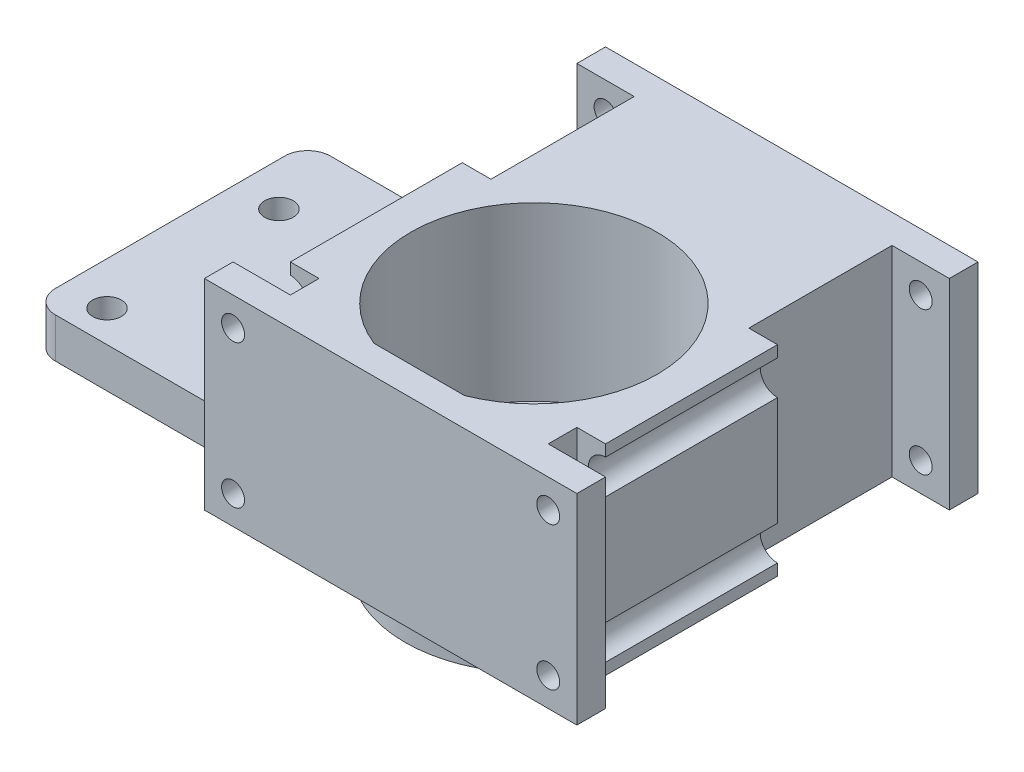
from build123d import *

# Parameters (mm, degrees)
SKETCH_1_W          = 45
SKETCH_1_H          = 70
SKETCH_1_R          = 21.5
EXTRUDE_1_DEPTH     = 35
SKETCH_2_R          = 21.5
EXTRUDE_2_DEPTH     = 5
SKETCH_3_R          = 2
SKETCH_3_R_2        = 13
CUT_EXTRUDE_1_DEPTH = 10
SKETCH_5_W          = 10
SKETCH_5_H          = 35
EXTRUDE_3_DEPTH     = 5
SKETCH_6_R          = 2
CUT_EXTRUDE_2_DEPTH = 5
EXTRUDE_START       = 5
SKETCH_8_R          = 22.5
SKETCH_8_R_2        = 13
SKETCH_8_R_3        = 2
EXTRUDE_5_DEPTH     = 5
SKETCH_9_R          = 4
CUT_EXTRUDE_3_DEPTH = 5
EXTRUDE_6_DEPTH     = 7
SKETCH_11_W         = 25
SKETCH_11_H         = 15
EXTRUDE_7_DEPTH     = 7
FILLET_1_R          = 4
SKETCH_12_R         = 2.5
CUT_EXTRUDE_4_DEPTH = 10
SKETCH_13_W         = 5
SKETCH_13_H         = 30
EXTRUDE_8_DEPTH     = 35
SKETCH_14_W         = 65
SKETCH_14_H         = 35
EXTRUDE_9_DEPTH     = 5
CUT_EXTRUDE_START   = -5
SKETCH_16_R         = 2
CUT_EXTRUDE_5_DEPTH = 5
SKETCH_18_R         = 3
CUT_EXTRUDE_6_DEPTH = 31


with BuildPart() as part:
    # 草图1 → 凸台-拉伸1 (new body)
    with BuildSketch(Plane(origin=(0, 0, 0), x_dir=(1, 0, 0), z_dir=(0, 1, 0))):
        Rectangle(SKETCH_1_W, SKETCH_1_H)
        with Locations(Location((0, -10, 0), (0, 0, 270))):
            Circle(SKETCH_1_R, mode=Mode.SUBTRACT)
    extrude(amount=EXTRUDE_1_DEPTH)

    # 草图2 → 凸台-拉伸2 (add)
    with BuildSketch(Plane.XZ):
        with Locations(Location((0, 10, 0), (0, 0, 270))):
            Circle(SKETCH_2_R)
    extrude(amount=-EXTRUDE_2_DEPTH)

    # 草图3 → 切除-拉伸1 (cut)
    with BuildSketch(Plane.XZ):
        with Locations(Location((0, -7.5, 0), (0, 0, 270))):
            Circle(SKETCH_3_R)
        with Locations(Location((-17.5, 10, 0), (0, 0, 270))):
            Circle(SKETCH_3_R)
        with Locations(Location((0, 27.5, 0), (0, 0, 270))):
            Circle(SKETCH_3_R)
        with Locations(Location((17.5, 10, 0), (0, 0, 270))):
            Circle(SKETCH_3_R)
        with Locations(Location((0, 10, 0), (0, 0, 270))):
            Circle(SKETCH_3_R_2)
    extrude(amount=-CUT_EXTRUDE_1_DEPTH, mode=Mode.SUBTRACT)

    # 草图5 → 凸台-拉伸3 (add)
    with BuildSketch(Plane(origin=(0, 0, -35), x_dir=(-1, 0, 0), z_dir=(0, 0, -1))):
        with Locations((27.5, 17.5)):
            Rectangle(SKETCH_5_W, SKETCH_5_H)
        with Locations((-27.5, 17.5)):
            Rectangle(SKETCH_5_W, SKETCH_5_H)
    extrude(amount=-EXTRUDE_3_DEPTH)

    # 草图6 → 切除-拉伸2 (cut)
    with BuildSketch(Plane.XY.offset(-30)):
        with Locations((27.5, 30)):
            Circle(SKETCH_6_R)
        with Locations((27.5, 5)):
            Circle(SKETCH_6_R)
        with Locations((-27.5, 30)):
            Circle(SKETCH_6_R)
        with Locations((-27.5, 5)):
            Circle(SKETCH_6_R)
    extrude(amount=-CUT_EXTRUDE_2_DEPTH, mode=Mode.SUBTRACT)

    # 草图8 → 凸台-拉伸5 (add)
    with BuildSketch(Plane.XZ.offset(EXTRUDE_START)):
        with Locations(Location((0, 10, 0), (0, 0, 180))):
            Circle(SKETCH_8_R)
        with Locations(Location((0, 10, 0), (0, 0, 270))):
            Circle(SKETCH_8_R_2, mode=Mode.SUBTRACT)
        with Locations(Location((-17.5, 10, 0), (0, 0, 270))):
            Circle(SKETCH_8_R_3, mode=Mode.SUBTRACT)
        with Locations(Location((0, -7.5, 0), (0, 0, 270))):
            Circle(SKETCH_8_R_3, mode=Mode.SUBTRACT)
        with Locations(Location((17.5, 10, 0), (0, 0, 270))):
            Circle(SKETCH_8_R_3, mode=Mode.SUBTRACT)
        with Locations(Location((0, 27.5, 0), (0, 0, 270))):
            Circle(SKETCH_8_R_3, mode=Mode.SUBTRACT)
    extrude(amount=-EXTRUDE_5_DEPTH)

    # 草图9 → 切除-拉伸3 (cut)
    with BuildSketch(Plane.XZ.offset(5)):
        with Locations(Location((0, 27.5, 0), (0, 0, 270))):
            Circle(SKETCH_9_R)
        with Locations(Location((-17.5, 10, 0), (0, 0, 270))):
            Circle(SKETCH_9_R)
        with Locations(Location((17.5, 10, 0), (0, 0, 270))):
            Circle(SKETCH_9_R)
        with Locations(Location((0, -7.5, 0), (0, 0, 270))):
            Circle(SKETCH_9_R)
    extrude(amount=-CUT_EXTRUDE_3_DEPTH, mode=Mode.SUBTRACT)

    # 草图10 → 凸台-拉伸6 (add)
    with BuildSketch(Plane.XZ.offset(5)):
        with BuildLine():
            Line((-19.899748742, 20.5), (-77, 20.5))
            Line((-77, 20.5), (-77, -12.5))
            Line((-77, -12.5), (0, -12.5))
            ThreePointArc((0, -12.5), (-19.267848868, -1.618950039), (-19.899748742, 20.5))
        make_face()
    extrude(amount=-EXTRUDE_6_DEPTH)

    # 草图11 → 凸台-拉伸7 (add)
    with BuildSketch(Plane.XZ.offset(5)):
        with Locations((-64.5, -20)):
            Rectangle(SKETCH_11_W, SKETCH_11_H)
    extrude(amount=-EXTRUDE_7_DEPTH)

    # 圆角1
    fillet_1_edges = [part.edges().sort_by_distance(p)[0] for p in [
        (-77, -1.5, 20.5),
        (-77, -1.5, -27.5),
        (-52, -1.5, -12.5),
        (-52, -1.5, -27.5),
    ]]
    fillet(fillet_1_edges, radius=FILLET_1_R)

    # 草图12 → 切除-拉伸4 (cut)
    with BuildSketch(Plane.XZ.offset(5)):
        with Locations(Location((-69.5, -15, 0), (0, 0, 270))):
            Circle(SKETCH_12_R)
        with Locations(Location((-69.5, 15, 0), (0, 0, 270))):
            Circle(SKETCH_12_R)
    extrude(amount=-CUT_EXTRUDE_4_DEPTH, mode=Mode.SUBTRACT)

    # 草图13 → 凸台-拉伸8 (add)
    with BuildSketch(Plane(origin=(0, 0, 0), x_dir=(1, 0, 0), z_dir=(0, 1, 0))):
        with Locations((25, -10)):
            Rectangle(SKETCH_13_W, SKETCH_13_H)
        with Locations((-25, -10)):
            Rectangle(SKETCH_13_W, SKETCH_13_H)
    extrude(amount=EXTRUDE_8_DEPTH)

    # 草图14 → 凸台-拉伸9 (add)
    with BuildSketch(Plane.XY.offset(35)):
        with Locations((0, 17.5)):
            Rectangle(SKETCH_14_W, SKETCH_14_H)
    extrude(amount=-EXTRUDE_9_DEPTH)

    # 草图16 → 切除-拉伸5 (cut)
    with BuildSketch(Plane(origin=(0, 0, 30), x_dir=(-1, 0, 0), z_dir=(0, 0, -1)).offset(CUT_EXTRUDE_START)):
        with Locations(Location((-27.5, 30, 0), (0, 0, 180))):
            Circle(SKETCH_16_R)
        with Locations(Location((-27.5, 5, 0), (0, 0, 180))):
            Circle(SKETCH_16_R)
        with Locations(Location((27.5, 30, 0), (0, 0, 180))):
            Circle(SKETCH_16_R)
        with Locations(Location((27.5, 5, 0), (0, 0, 180))):
            Circle(SKETCH_16_R)
    extrude(amount=CUT_EXTRUDE_5_DEPTH, mode=Mode.SUBTRACT)

    # 草图18 → 切除-拉伸6 (cut)
    with BuildSketch(Plane(origin=(0, 0, -5), x_dir=(-1, 0, 0), z_dir=(0, 0, -1))):
        with Locations((27.5, 30)):
            Circle(SKETCH_18_R)
        with Locations((27.5, 5)):
            Circle(SKETCH_18_R)
        with Locations((-27.5, 5)):
            Circle(SKETCH_18_R)
        with Locations((-27.5, 30)):
            Circle(SKETCH_18_R)
    extrude(amount=-CUT_EXTRUDE_6_DEPTH, mode=Mode.SUBTRACT)


solid = part.part
